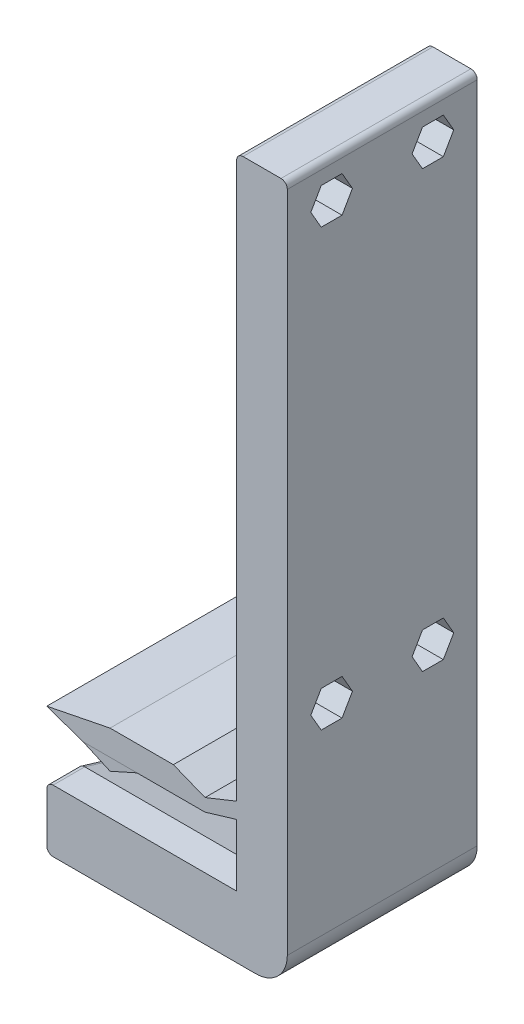
from build123d import *

# Parameters (mm, degrees)
SKETCH1_W           = 8
SKETCH1_H           = 80.8
BOSS_EXTRUDE1_DEPTH = 30
SKETCH2_R           = 1.65
CUT_EXTRUDE1_DEPTH  = 30
CUT_EXTRUDE3_DEPTH  = 5
SKETCH4_W           = 8
SKETCH4_H           = 30
BOSS_EXTRUDE2_DEPTH = 30
SKETCH5_W           = 30
SKETCH5_H           = 9.8
BOSS_EXTRUDE3_DEPTH = 30
SKETCH6_W           = 30
SKETCH6_H           = 4
BOSS_EXTRUDE4_DEPTH = 30
BOSS_EXTRUDE5_DEPTH = 30
CUT_EXTRUDE8_DEPTH  = 30
CUT_EXTRUDE9_DEPTH  = 30
CUT_EXTRUDE10_DEPTH = 30
FILLET1_R           = 1
FILLET2_R           = 5
FILLET3_R           = 1


with BuildPart() as part:
    # Sketch1 → Boss-Extrude1 (new body)
    with BuildSketch(Plane.XY):
        with Locations((-17.25, 0)):
            Rectangle(SKETCH1_W, SKETCH1_H)
    extrude(amount=BOSS_EXTRUDE1_DEPTH)

    # Sketch2 → Cut-Extrude1 (cut)
    with BuildSketch(Plane(origin=(-13.25, 0, 0), x_dir=(0, 0, -1), z_dir=(1, 0, 0))):
        with Locations((-7, 34.4)):
            Circle(SKETCH2_R)
        with Locations((-23, 34.4)):
            Circle(SKETCH2_R)
        with Locations((-23, -34.4)):
            Circle(SKETCH2_R)
        with Locations((-7, -34.4)):
            Circle(SKETCH2_R)
    extrude(amount=-CUT_EXTRUDE1_DEPTH, mode=Mode.SUBTRACT)

    # Sketch3 → Cut-Extrude3 (cut, symmetric)
    with BuildSketch(Plane(origin=(-13.25, 0, 0), x_dir=(0, 0, -1), z_dir=(1, 0, 0))):
        Polygon((-26.290896534, 34.4), (-24.645448267, 31.55), (-21.354551733, 31.55), (-19.709103466, 34.4), (-21.354551733, 37.25), (-24.645448267, 37.25), align=None)
        Polygon((-10.290896534, 34.4), (-8.645448267, 31.55), (-5.354551733, 31.55), (-3.709103466, 34.4), (-5.354551733, 37.25), (-8.645448267, 37.25), align=None)
        Polygon((-19.709103466, -34.4), (-21.354551733, -31.55), (-24.645448267, -31.55), (-26.290896534, -34.4), (-24.645448267, -37.25), (-21.354551733, -37.25), align=None)
        Polygon((-3.709103466, -34.4), (-5.354551733, -31.55), (-8.645448267, -31.55), (-10.290896534, -34.4), (-8.645448267, -37.25), (-5.354551733, -37.25), align=None)
    extrude(amount=CUT_EXTRUDE3_DEPTH, both=True, mode=Mode.SUBTRACT)

    # Sketch4 → Boss-Extrude2 (add)
    with BuildSketch(Plane.XZ.offset(40.4)):
        with Locations((-17.25, 15)):
            Rectangle(SKETCH4_W, SKETCH4_H)
    extrude(amount=BOSS_EXTRUDE2_DEPTH)

    # Sketch5 → Boss-Extrude3 (add)
    with BuildSketch(Plane.ZY.offset(21.25)):
        with Locations((15, -65.5)):
            Rectangle(SKETCH5_W, SKETCH5_H)
    extrude(amount=BOSS_EXTRUDE3_DEPTH)

    # Sketch6 → Boss-Extrude4 (add)
    with BuildSketch(Plane.ZY.offset(21.25)):
        with Locations((15, -50.3)):
            Rectangle(SKETCH6_W, SKETCH6_H)
    extrude(amount=BOSS_EXTRUDE4_DEPTH)

    # Sketch9 → Cut-Extrude8 (cut)
    with BuildSketch(Plane(origin=(0, 0, 0), x_dir=(-1, 0, 0), z_dir=(0, 0, -1))):
        Polygon((51.25, -48.3), (41.25, -48.3), (51.25, -50.3), align=None)
        Polygon((26.25, -50.3), (31.25, -48.3), (21.25, -48.3), align=None)
    extrude(amount=-CUT_EXTRUDE8_DEPTH, mode=Mode.SUBTRACT)

    # Sketch10 → Cut-Extrude9 (cut)
    with BuildSketch(Plane.ZY.offset(51.25)):
        Polygon((5, -60.6), (25, -60.6), (15, -63.6), align=None)
    extrude(amount=-CUT_EXTRUDE9_DEPTH, mode=Mode.SUBTRACT)

    # Sketch11 → Cut-Extrude10 (cut)
    with BuildSketch(Plane(origin=(0, 0, 0), x_dir=(-1, 0, 0), z_dir=(0, 0, -1))):
        Polygon((45.5, -52.3), (51.25, -50.3), (51.25, -52.3), align=None)
        Polygon((21.25, -52.3), (21.25, -50.8), (26.25, -52.3), align=None)
    extrude(amount=-CUT_EXTRUDE10_DEPTH, mode=Mode.SUBTRACT)

    # Fillet1
    fillet1_edges = [part.edges().sort_by_distance(p)[0] for p in [
        (-51.25, -70.4, 15),
        (-51.25, -60.6, 27.5),
        (-51.25, -60.6, 2.5),
        (-51.25, -62.1, 20),
        (-51.25, -62.1, 10),
    ]]
    fillet(fillet1_edges, radius=FILLET1_R)

    # Fillet2
    fillet2_edges = [part.edges().sort_by_distance(p)[0] for p in [
        (-13.25, -70.4, 15),
    ]]
    fillet(fillet2_edges, radius=FILLET2_R)

    # Fillet3
    fillet3_edges = [part.edges().sort_by_distance(p)[0] for p in [
        (-21.25, 40.4, 15),
        (-13.25, 40.4, 15),
    ]]
    fillet(fillet3_edges, radius=FILLET3_R)


with BuildPart() as body_2:
    # Sketch8 → Boss-Extrude5 (new body)
    with BuildSketch(Plane(origin=(0, 0, 0), x_dir=(-1, 0, 0), z_dir=(0, 0, -1))):
        Polygon((37, -52.3), (45.5, -52.3), (41.25, -54.2), align=None)
    extrude(amount=-BOSS_EXTRUDE5_DEPTH)


solid = Compound([part.part, body_2.part])
